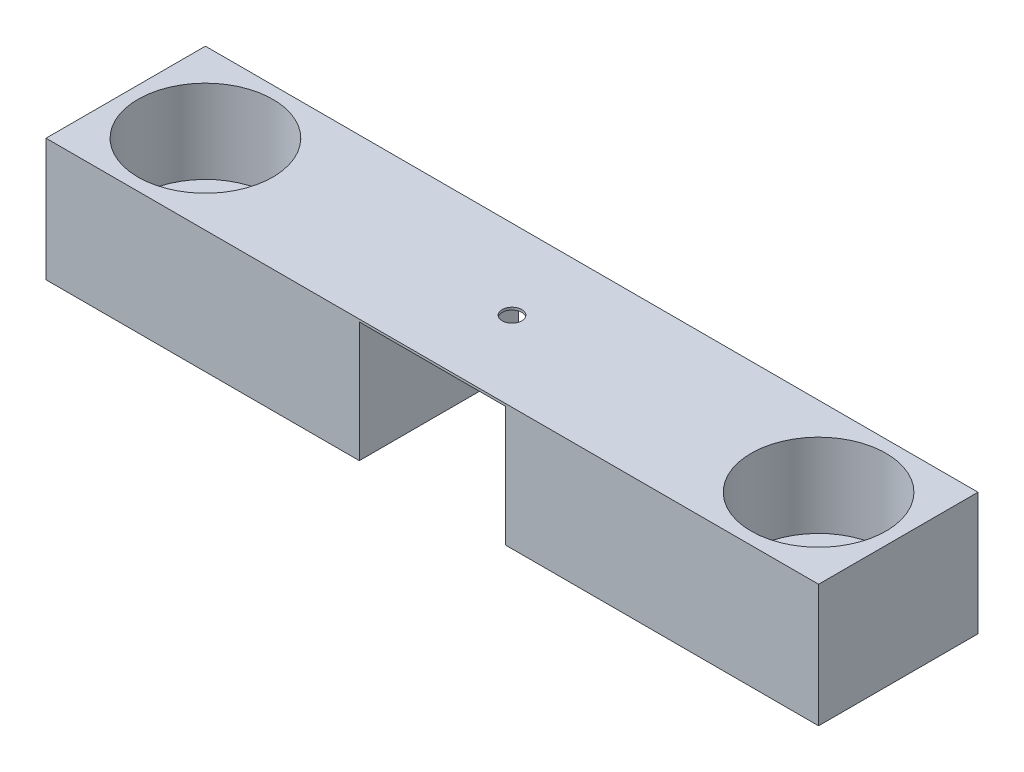
from build123d import *

# Parameters (mm, degrees)
SKETCH_1_W                = 63
SKETCH_1_H                = 13
EXTRUDE_1_DEPTH           = 10
HOLE_WIZARD_1_D           = 6.6
HOLE_WIZARD_1_CBORE_D     = 11
HOLE_WIZARD_1_CBORE_DEPTH = 6.8
MM_1_D                    = 4
MM_1_DEPTH                = 5
MM_1_TIP                  = 1.201721238
CUT_EXTRUDE_1_DEPTH       = 5
HOLE_WIZARD_M2_1_D        = 1.6
SKETCH_9_W                = 11.9
SKETCH_9_H                = 9.8
CUT_EXTRUDE_2_DEPTH       = 36.514081714


with BuildPart() as part:
    # 草图1 → 凸台-拉伸1 (new body)
    with BuildSketch(Plane(origin=(0, 0, 0), x_dir=(1, 0, 0), z_dir=(0, 1, 0))):
        Rectangle(SKETCH_1_W, SKETCH_1_H)
    extrude(amount=EXTRUDE_1_DEPTH)

    # 打孔尺寸(%根据)内六角圆柱头螺钉的类型1 (through all)
    with Locations(Plane(origin=(-25, 10, 0), x_dir=(0, 0, 1), z_dir=(0, 1, 0))):
        with Locations((0, 0), (0, 50)):
            CounterBoreHole(HOLE_WIZARD_1_D / 2, HOLE_WIZARD_1_CBORE_D / 2, HOLE_WIZARD_1_CBORE_DEPTH)

    # 大小mm 暗销孔1
    with Locations(Plane(origin=(-15, 0, 0), x_dir=(0, 0, -1), z_dir=(0, -1, 0))):
        with Locations((0, 0)):
            Hole(MM_1_D / 2, depth=MM_1_DEPTH)
            with Locations((0, 0, -(MM_1_DEPTH + MM_1_TIP / 2))):  # 118° drill point
                Cone(0, MM_1_D / 2, MM_1_TIP, mode=Mode.SUBTRACT)

    # 草图6 → 切除-拉伸1 (cut)
    with BuildSketch(Plane.XZ):
        with BuildLine():
            Line((14.5, 2), (15.5, 2))
            ThreePointArc((15.5, 2), (17.5, 0), (15.5, -2))
            Line((15.5, -2), (14.5, -2))
            ThreePointArc((14.5, -2), (12.5, 0), (14.5, 2))
        make_face()
    extrude(amount=-CUT_EXTRUDE_1_DEPTH, mode=Mode.SUBTRACT)

    # M2 螺纹孔1 (through all)
    with Locations(Plane.ZX.offset(10)):
        with Locations((0, 0)):
            Hole(HOLE_WIZARD_M2_1_D / 2)

    # 草图9 → 切除-拉伸2 (cut, through all)
    with BuildSketch(Plane.XY.offset(6.5)):
        with Locations((0, 4.9)):
            Rectangle(SKETCH_9_W, SKETCH_9_H)
    extrude(amount=-CUT_EXTRUDE_2_DEPTH, mode=Mode.SUBTRACT)


solid = part.part
